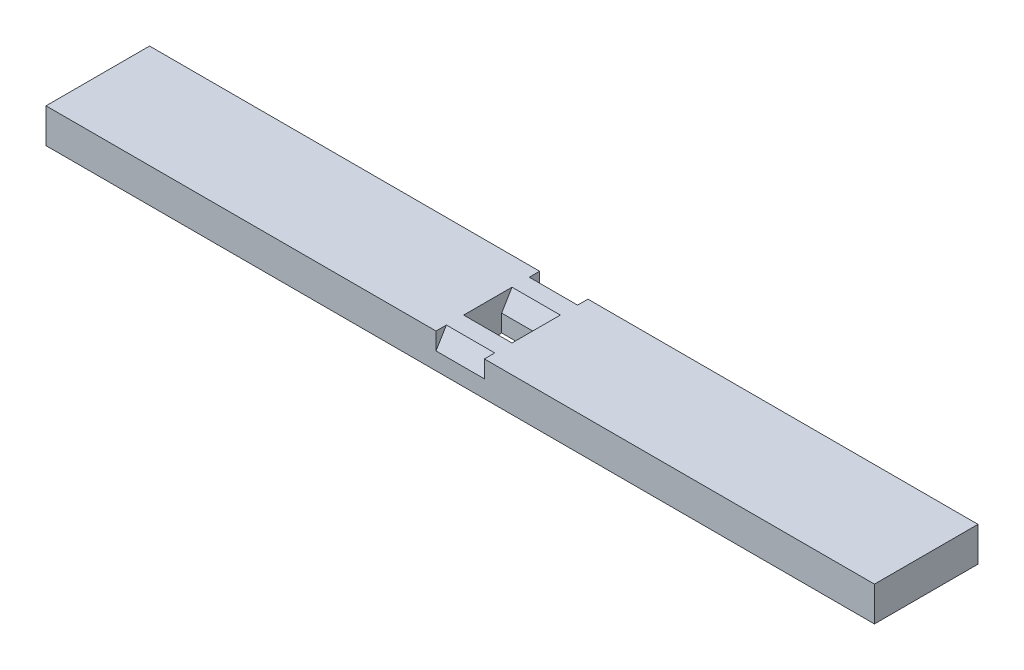
from build123d import *

# Parameters (mm, degrees)
SKETCH1_W           = 120
SKETCH1_H           = 15
BOSS_EXTRUDE1_DEPTH = 5
SKETCH2_W           = 7
SKETCH2_H           = 4
CUT_EXTRUDE1_DEPTH  = 10
CUT_EXTRUDE2_DEPTH  = 7


with BuildPart() as part:
    # Sketch1 → Boss-Extrude1 (new body)
    with BuildSketch(Plane(origin=(0, 0, 0), x_dir=(1, 0, 0), z_dir=(0, 1, 0))):
        with Locations((60, 7.5)):
            Rectangle(SKETCH1_W, SKETCH1_H)
    extrude(amount=BOSS_EXTRUDE1_DEPTH)

    # Sketch2 → Cut-Extrude1 (cut)
    with BuildSketch(Plane(origin=(0, 5, 0), x_dir=(1, 0, 0), z_dir=(0, 1, 0))):
        with Locations((60, 7.5)):
            Rectangle(SKETCH2_W, SKETCH2_H)
    extrude(amount=-CUT_EXTRUDE1_DEPTH, mode=Mode.SUBTRACT)

    # Sketch3 → Cut-Extrude2 (cut)
    with BuildSketch(Plane(origin=(56.5, 0, 0), x_dir=(0, 0, -1), z_dir=(1, 0, 0))):
        Polygon((5.5, 5), (3.997858335, 5), (5.5, 2.5), align=None)
        Polygon((9.5, 5), (11, 5), (9.5, 2.5), align=None)
        Polygon((1.5, 5), (0, 2.5), (0, 5), align=None)
        Polygon((13.5, 5), (15, 2.5), (15, 5), align=None)
    extrude(amount=CUT_EXTRUDE2_DEPTH, mode=Mode.SUBTRACT)


solid = part.part
